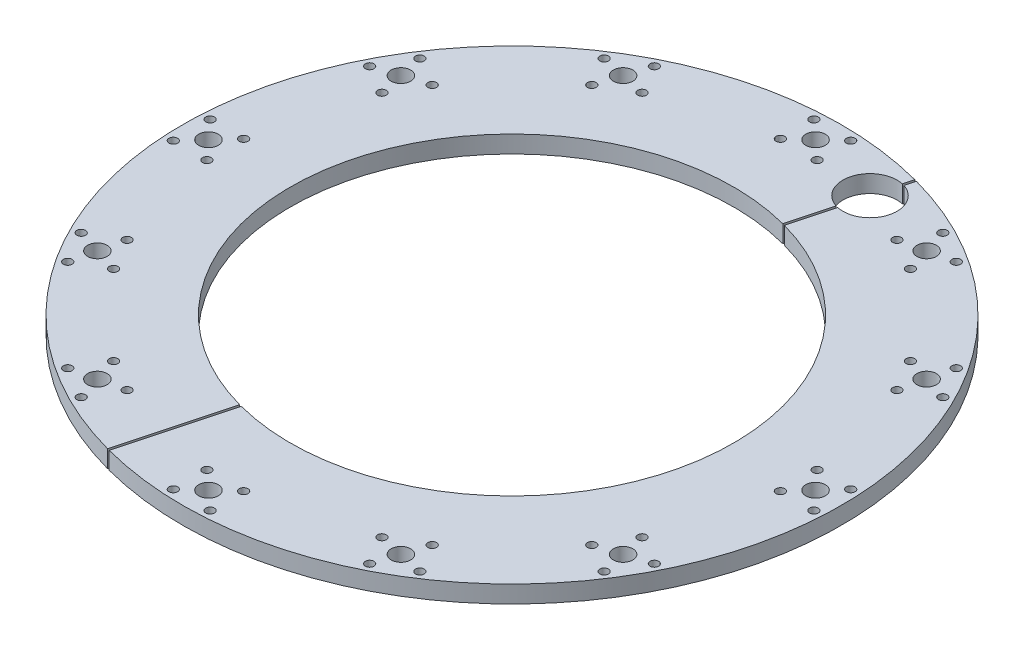
from build123d import *

# Parameters (mm, degrees)
SKETCH1_R           = 76.1
SKETCH1_R_2         = 51.2
BOSS_EXTRUDE1_DEPTH = 4
SKETCH2_R           = 2.25
SKETCH2_R_2         = 1
CUT_EXTRUDE1_DEPTH  = 108.695960927
CIRPATTERN1_COUNT   = 12
SKETCH3_R           = 6.25
CUT_EXTRUDE2_DEPTH  = 10
CUT_EXTRUDE3_DEPTH  = 108.695960927


with BuildPart() as part:
    # Sketch1 → Boss-Extrude1 (new body)
    with BuildSketch(Plane(origin=(0, 0, 0), x_dir=(1, 0, 0), z_dir=(0, 1, 0))):
        Circle(SKETCH1_R)
        Circle(SKETCH1_R_2, mode=Mode.SUBTRACT)
    extrude(amount=BOSS_EXTRUDE1_DEPTH)

    # Sketch2 → Cut-Extrude1 (cut, through all)
    with BuildSketch(Plane(origin=(0, 4, 0), x_dir=(1, 0, 0), z_dir=(0, 1, 0))):
        with Locations((0, 70.091449319)):
            Circle(SKETCH2_R)
        with Locations((4.246572956, 73.968189977)):
            Circle(SKETCH2_R_2)
        with Locations((4.246572956, 66.214708661)):
            Circle(SKETCH2_R_2)
        with Locations((-4.246572956, 66.214708661)):
            Circle(SKETCH2_R_2)
        with Locations((-4.246572956, 73.968189977)):
            Circle(SKETCH2_R_2)
    cut_extrude1 = extrude(amount=-CUT_EXTRUDE1_DEPTH, mode=Mode.SUBTRACT)

    # CirPattern1: Cut-Extrude1 ×12 about axis
    cirpattern1_axis = Axis((0, -0.2, 0), (0, 1, 0))
    for i in range(1, CIRPATTERN1_COUNT):
        add(cut_extrude1.rotate(cirpattern1_axis, i * 360 / CIRPATTERN1_COUNT), mode=Mode.SUBTRACT)

    # Sketch3 → Cut-Extrude2 (cut)
    with BuildSketch(Plane(origin=(0, 4, 0), x_dir=(1, 0, 0), z_dir=(0, 1, 0))):
        with Locations((17.470285544, 65.199993275)):
            Circle(SKETCH3_R)
    extrude(amount=-CUT_EXTRUDE2_DEPTH, mode=Mode.SUBTRACT)

    # Sketch4 → Cut-Extrude3 (cut, through all)
    with BuildSketch(Plane(origin=(0, 4, 0), x_dir=(1, 0, 0), z_dir=(0, 1, 0))):
        Polygon((21.667592424, 79.898629977), (-26.277858968, -99.03623061), (-26.760821881, -98.906821087), (21.184629511, 80.028039499), align=None)
    extrude(amount=-CUT_EXTRUDE3_DEPTH, mode=Mode.SUBTRACT)


with BuildPart() as cut_extrude3_piece_1:
    # of the separate pieces the step leaves, piece 1, a body of its own (cut_extrude3_pieces)
    add(part.part.solids().sort_by_distance((-19.454541593, 0, 73.571263489))[0])


with BuildPart() as cut_extrude3_piece_2:
    # of the separate pieces the step leaves, piece 2, a body of its own (cut_extrude3_pieces)
    add(part.part.solids().sort_by_distance((19.454541593, 0, -73.571263489))[0])


solid = Compound([cut_extrude3_piece_1.part, cut_extrude3_piece_2.part])
